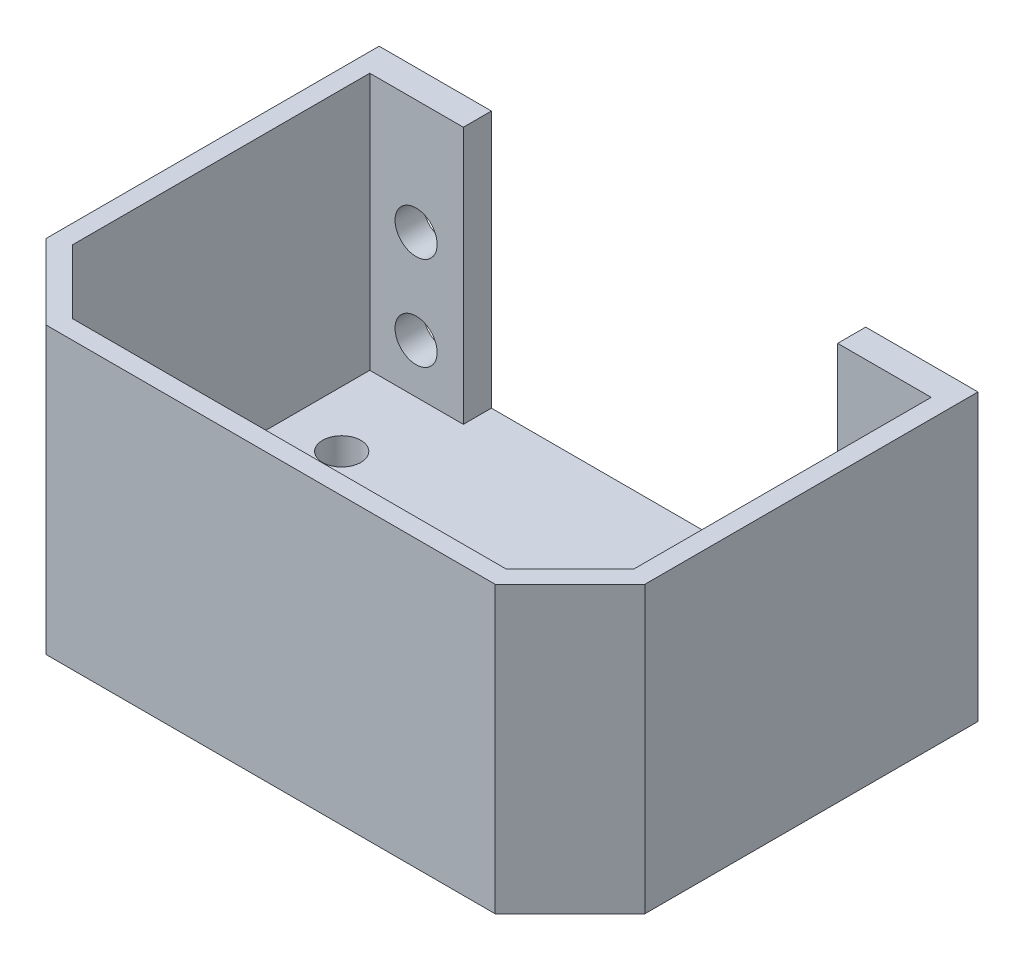
from build123d import *

# Parameters (mm, degrees)
SKETCH1_W               = 12
SKETCH1_H               = 20.5
ARM_MOUNTS_DEPTH        = 3
ARM_MOUNTS_2_DEPTH      = 3
ARM_HOLES_DEPTH         = 34.735181932
ARM_HOLES_DEPTH_BACK    = 3
SKETCH2_R               = 2.25
SKETCH3_W               = 64
SKETCH3_H               = 3
BOTTOM_PLATE_DEPTH      = 28
SIDE_RIBS_DEPTH         = 2
SKETCH5_W               = 36
SKETCH5_H               = 12
CUT_EXTRUDE2_DEPTH      = 10
SKETCH6_R               = 2.05
MOUNTING_HOLES_DEPTH    = 10
CUT_EXTRUDE4_DEPTH      = 48.204343021
CUT_EXTRUDE4_DEPTH_BACK = 48.204343021
SKETCH8_W               = 64
SKETCH8_H               = 6.2
SKETCH10_W              = 64
SKETCH10_H              = 21.8
BOSS_EXTRUDE7_DEPTH     = 3
CHAMFER3_SIZE           = 5
CHAMFER4_SIZE           = 2.5
CHAMFER5_SIZE           = 8
CUT_EXTRUDE5_DEPTH      = 10
BOSS_EXTRUDE8_DEPTH     = 20.5
BOSS_EXTRUDE9_DEPTH     = 7


with BuildPart() as part:
    # Sketch1 → Arm Mounts (new body)
    with BuildSketch(Plane.XY):
        with Locations((26, 0)):
            Rectangle(SKETCH1_W, SKETCH1_H)
    extrude(amount=ARM_MOUNTS_DEPTH)


with BuildPart() as body_2:
    # Sketch1 → Arm Mounts 2 (new body)
    with BuildSketch(Plane.XY):
        with Locations((-26, 0)):
            Rectangle(SKETCH1_W, SKETCH1_H)
    extrude(amount=ARM_MOUNTS_2_DEPTH)


with BuildPart() as arm_holes_tool:
    # Sketch2 → Arm Holes (new, two sides: drawn at the far end of the back side and taken through both)
    with BuildSketch(Plane(origin=(0, 0, 3), x_dir=(-1, 0, 0), z_dir=(0, 0, -1)).offset(-ARM_HOLES_DEPTH_BACK)):
        with Locations(Location((25.05, 5, 0), (0, 0, 180))):
            Circle(SKETCH2_R)
        with Locations(Location((25.05, -5, 0), (0, 0, 180))):
            Circle(SKETCH2_R)
        with Locations(Location((-25.05, -5, 0), (0, 0, 180))):
            Circle(SKETCH2_R)
        with Locations(Location((-25.05, 5, 0), (0, 0, 180))):
            Circle(SKETCH2_R)
    extrude(amount=ARM_HOLES_DEPTH + ARM_HOLES_DEPTH_BACK)


with BuildPart() as part_1:
    add(part.part)

    # Arm Holes: cut by arm_holes_tool
    add(arm_holes_tool.part, mode=Mode.SUBTRACT)



with BuildPart() as body_2_1:
    add(body_2.part)

    # Arm Holes: cut by arm_holes_tool
    add(arm_holes_tool.part, mode=Mode.SUBTRACT)


with BuildPart() as part_2:
    add(part_1.part)

    add(body_2_1.part)  # Bottom Plate merges body 2
    # Sketch3 → Bottom Plate (add)
    with BuildSketch(Plane(origin=(0, 0, 0), x_dir=(-1, 0, 0), z_dir=(0, 0, -1))):
        with Locations((0, -11.75)):
            Rectangle(SKETCH3_W, SKETCH3_H)
    extrude(amount=-BOTTOM_PLATE_DEPTH)

    # Sketch4 → Side Ribs (add)
    with BuildSketch(Plane.ZY.offset(32)):
        Polygon((3, 10.25), (28, -10.25), (3, -10.25), align=None)
    side_ribs = extrude(amount=-SIDE_RIBS_DEPTH)

    # Rib Mirror: Side Ribs across plane
    add(side_ribs.mirror(Plane(origin=(0, 0, 0), x_dir=(0, 0, 1), z_dir=(1, 0, 0))))

    # Sketch5 → Cut-Extrude2 (cut)
    with BuildSketch(Plane(origin=(0, -10.25, 0), x_dir=(1, 0, 0), z_dir=(0, 1, 0))):
        with Locations((10, -22)):
            Rectangle(SKETCH5_W, SKETCH5_H)
    cut_extrude2 = extrude(amount=-CUT_EXTRUDE2_DEPTH, mode=Mode.SUBTRACT)

    # Sketch6 → Mounting Holes (cut)
    with BuildSketch(Plane(origin=(0, -10.25, 0), x_dir=(1, 0, 0), z_dir=(0, 1, 0))):
        with Locations(Location((-24, -12, 0), (0, 0, 270))):
            Circle(SKETCH6_R)
        with Locations(Location((24, -10, 0), (0, 0, 270))):
            Circle(SKETCH6_R)
    mounting_holes = extrude(amount=-MOUNTING_HOLES_DEPTH, mode=Mode.SUBTRACT)

    # Sketch8 → Cut-Extrude4 (cut, two sides: drawn at the far end of the back side and taken through both)
    with BuildSketch(Plane(origin=(0, -10.25, 0), x_dir=(1, 0, 0), z_dir=(0, 1, 0)).offset(-CUT_EXTRUDE4_DEPTH_BACK)):
        with Locations((0, -24.9)):
            Rectangle(SKETCH8_W, SKETCH8_H)
    extrude(amount=CUT_EXTRUDE4_DEPTH + CUT_EXTRUDE4_DEPTH_BACK, mode=Mode.SUBTRACT)

    # Sketch10 → Boss-Extrude7 (add)
    with BuildSketch(Plane(origin=(0, -10.25, 0), x_dir=(1, 0, 0), z_dir=(0, 1, 0))):
        with Locations((0, -32.7)):
            Rectangle(SKETCH10_W, SKETCH10_H)
    extrude(amount=-BOSS_EXTRUDE7_DEPTH)

    # Mirror5: Cut-Extrude2, Mounting Holes across plane
    add(cut_extrude2.mirror(Plane.XY.offset(21.8)), mode=Mode.SUBTRACT)
    add(mounting_holes.mirror(Plane.XY.offset(21.8)), mode=Mode.SUBTRACT)

    # Chamfer3
    chamfer3_edges = [part_2.edges().sort_by_distance(p)[0] for p in [
        (31, -10.25, 21.8),
        (-31, -10.25, 21.8),
    ]]
    chamfer(chamfer3_edges, length=CHAMFER3_SIZE)

    # Chamfer4
    chamfer4_edges = [part_2.edges().sort_by_distance(p)[0] for p in [
        (28, -11.75, 15.6),
        (28, -11.75, 27.6),
        (-8, -11.75, 27.6),
        (-8, -11.75, 15.6),
    ]]
    chamfer(chamfer4_edges, length=CHAMFER4_SIZE)

    # Chamfer5
    chamfer5_edges = [part_2.edges().sort_by_distance(p)[0] for p in [
        (32, -11.75, 43.6),
        (-32, -11.75, 43.6),
    ]]
    chamfer(chamfer5_edges, length=CHAMFER5_SIZE)

    # Sketch11 → Cut-Extrude5 (cut)
    with BuildSketch(Plane(origin=(0, -10.25, 0), x_dir=(1, 0, 0), z_dir=(0, 1, 0))):
        Polygon((-8, -25.1), (-8, -26.514213562), (-5.914213562, -28.6), (25.914213562, -28.6), (28, -26.514213562), (28, -25.1), align=None)
    extrude(amount=-CUT_EXTRUDE5_DEPTH, mode=Mode.SUBTRACT)

    # Sketch12 → Boss-Extrude8 (add)
    with BuildSketch(Plane(origin=(0, -10.25, 0), x_dir=(1, 0, 0), z_dir=(0, 1, 0))):
        Polygon((-32, -26.8), (-32, -3), (-30, -3), (-30, -26.8), (-30, -34.771572875), (-23.171572875, -41.6), (23.171572875, -41.6), (30, -34.771572875), (30, -26.8), (30, -3), (32, -3), (32, -26.8), (32, -35.6), (24, -43.6), (-24, -43.6), (-32, -35.6), align=None)
    extrude(amount=BOSS_EXTRUDE8_DEPTH)

    # Sketch13 → Boss-Extrude9 (add)
    with BuildSketch(Plane(origin=(0, 10.25, 0), x_dir=(1, 0, 0), z_dir=(0, 1, 0))):
        Polygon((-20, 0), (-32, 0), (-32, -35.6), (-24, -43.6), (24, -43.6), (32, -35.6), (32, 0), (20, 0), (20, -3), (30, -3), (30, -34.771572875), (23.171572875, -41.6), (-23.171572875, -41.6), (-30, -34.771572875), (-30, -3), (-20, -3), align=None)
    extrude(amount=BOSS_EXTRUDE9_DEPTH)


solid = part_2.part
